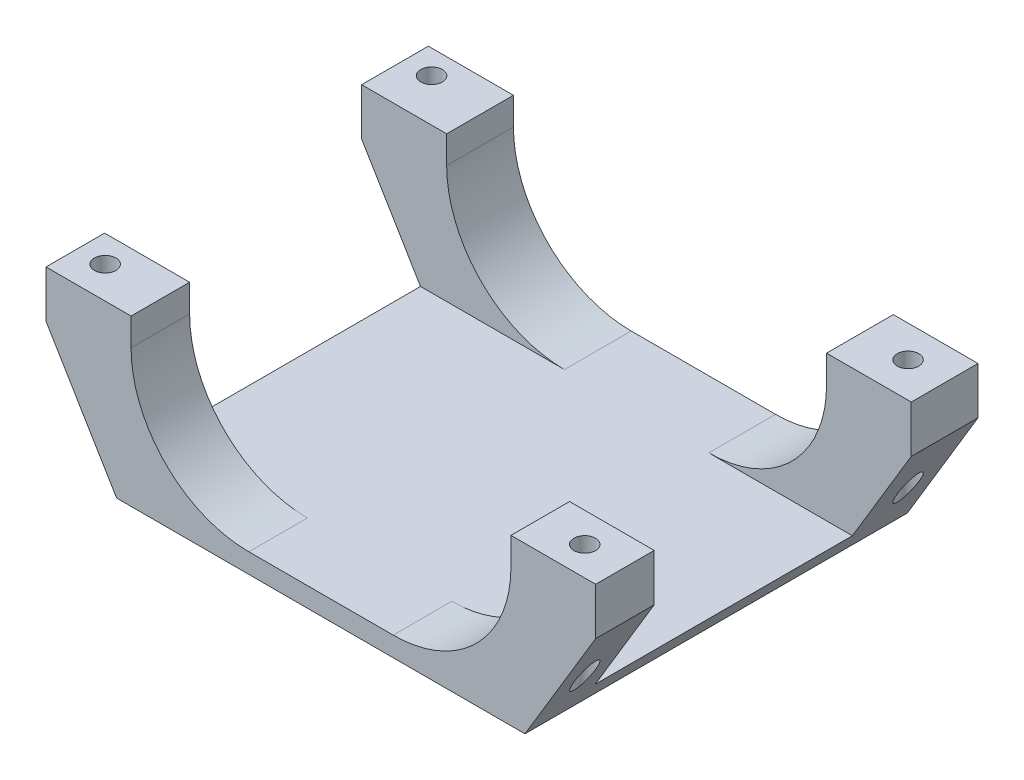
from build123d import *

# Parameters (mm, degrees)
PICOVER_DEPTH                       = 40
PICOVER_DEPTH_BACK                  = 2
SKETCH1_W                           = 139.991389113
SKETCH1_H                           = 97.393342316
SKETCH2_W                           = 96.759944342
SKETCH2_H                           = 98.11966003
OPENINGFORPI_DEPTH                  = 37
SKETCH4_W                           = 18
SKETCH4_H                           = 97.393342316
CUTAWAYSTHATDEFINESCREWPLATES_DEPTH = 30
BOSS_EXTRUDE1_DEPTH                 = 97.393342316
HOLEFORPOWERHDMIAUDIO_DEPTH         = 150
HOLEFORPOWERHDMIAUDIO_DEPTH_BACK    = 30
SKETCH6_W                           = 65.470403297
SKETCH6_H                           = 37
SKETCH7_R                           = 2.75
CUT_EXTRUDE7_DEPTH                  = 60
FILLET1_R                           = 30
FILLET2_R                           = 30
FILLET3_R                           = 30
FILLET4_R                           = 30


with BuildPart() as part:
    # Sketch1 → PiCover (new, two sides: drawn at the far end of the back side and taken through both)
    with BuildSketch(Plane(origin=(0, 0, 0), x_dir=(1, 0, 0), z_dir=(0, 1, 0)).offset(-PICOVER_DEPTH_BACK)):
        with Locations((69.995694556, 48.696671158)):
            Rectangle(SKETCH1_W, SKETCH1_H)
    extrude(amount=PICOVER_DEPTH + PICOVER_DEPTH_BACK)

    # Sketch2 → OpeningForPi (cut)
    with BuildSketch(Plane(origin=(0, 40, 0), x_dir=(1, 0, 0), z_dir=(0, 1, 0))):
        with Locations((70.044375284, 48.333512301)):
            Rectangle(SKETCH2_W, SKETCH2_H)
    extrude(amount=-OPENINGFORPI_DEPTH, mode=Mode.SUBTRACT)

    # Sketch4 → CutAwaysThatDefineScrewPlates (cut)
    with BuildSketch(Plane.XZ.offset(2)):
        with Locations((130.991389113, -48.696671158)):
            Rectangle(SKETCH4_W, SKETCH4_H)
        with Locations((9, -48.696671158)):
            Rectangle(SKETCH4_W, SKETCH4_H)
    extrude(amount=-CUTAWAYSTHATDEFINESCREWPLATES_DEPTH, mode=Mode.SUBTRACT)

    # Sketch11 → Boss-Extrude1 (add)
    with BuildSketch(Plane.XY):
        Polygon((0, 28), (18, 28), (18, -2), align=None)
        Polygon((139.991389113, 28), (121.991389113, 28), (121.991389113, -2), align=None)
    extrude(amount=-BOSS_EXTRUDE1_DEPTH)

    # Sketch6 → HoleForPowerHDMIAudio (cut, two sides: drawn at the far end of the back side and taken through both)
    with BuildSketch(Plane(origin=(21.664403113, 0, 0), x_dir=(0, 0, -1), z_dir=(1, 0, 0)).offset(-HOLEFORPOWERHDMIAUDIO_DEPTH_BACK)):
        with Locations((47.655232797, 21.5)):
            Rectangle(SKETCH6_W, SKETCH6_H)
    extrude(amount=HOLEFORPOWERHDMIAUDIO_DEPTH + HOLEFORPOWERHDMIAUDIO_DEPTH_BACK, mode=Mode.SUBTRACT)

    # Sketch7 → Cut-Extrude7 (cut)
    with BuildSketch(Plane(origin=(0, 40, 0), x_dir=(1, 0, 0), z_dir=(0, 1, 0))):
        with Locations(Location((6.934452889, 8.128892452, 0), (0, 0, 270))):
            Circle(SKETCH7_R)
        with Locations(Location((6.934452889, 91.275593332, 0), (0, 0, 270))):
            Circle(SKETCH7_R)
        with Locations(Location((130.288718206, 89.274198859, 0), (0, 0, 270))):
            Circle(SKETCH7_R)
        with Locations(Location((129.818664093, 7.39541328, 0), (0, 0, 270))):
            Circle(SKETCH7_R)
    extrude(amount=-CUT_EXTRUDE7_DEPTH, mode=Mode.SUBTRACT)

    # Fillet1
    fillet1_edges = [part.edges().sort_by_distance(p)[0] for p in [
        (21.664403113, 3, -88.891888381),
    ]]
    fillet(fillet1_edges, radius=FILLET1_R)

    # Fillet2
    fillet2_edges = [part.edges().sort_by_distance(p)[0] for p in [
        (118.424347455, 3, -88.891888381),
    ]]
    fillet(fillet2_edges, radius=FILLET2_R)

    # Fillet3
    fillet3_edges = [part.edges().sort_by_distance(p)[0] for p in [
        (21.664403113, 3, -7.460015574),
    ]]
    fillet(fillet3_edges, radius=FILLET3_R)

    # Fillet4
    fillet4_edges = [part.edges().sort_by_distance(p)[0] for p in [
        (118.424347455, 3, -7.460015574),
    ]]
    fillet(fillet4_edges, radius=FILLET4_R)


solid = part.part
